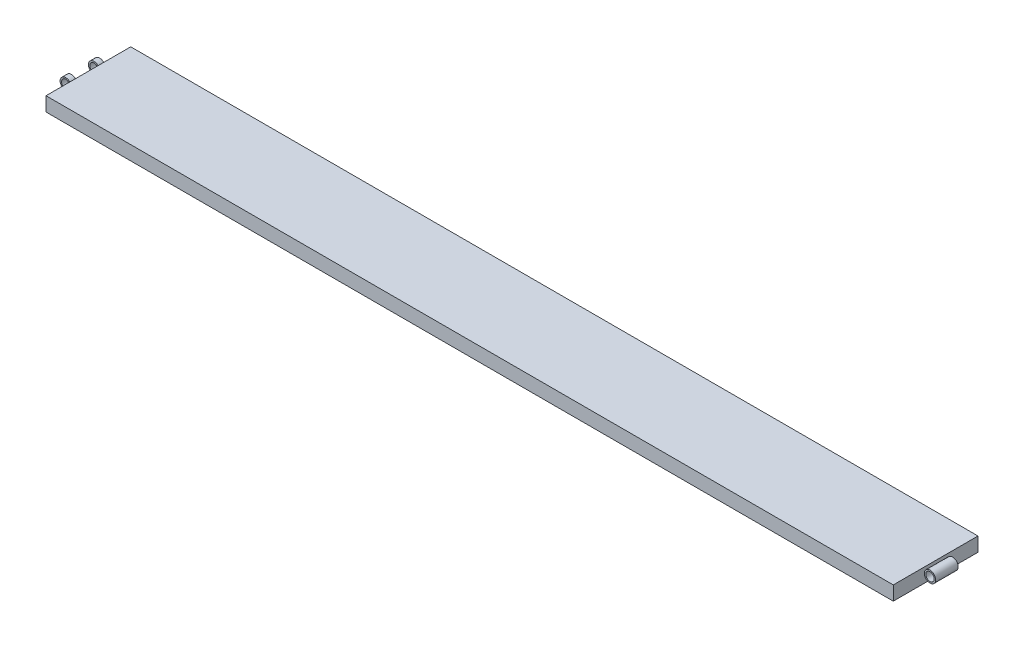
from build123d import *

# Parameters (mm, degrees)
SKETCH1_W                = 381
SKETCH1_H                = 38.1
BOSS_EXTRUDE1_DEPTH      = 6.35
SKETCH2_R                = 2.54
SKETCH2_R_2              = 1.905
BOSS_EXTRUDE2_DEPTH      = 1.27
LPATTERN1_COUNT          = 2
LPATTERN1_PITCH          = 12.7
BOSS_EXTRUDE4_DEPTH      = 5.08
BOSS_EXTRUDE4_DEPTH_BACK = 5.08
SKETCH4_R                = 2.54
SKETCH4_R_2              = 1.905


with BuildPart() as part:
    # Sketch1 → Boss-Extrude1 (new body)
    with BuildSketch(Plane(origin=(0, 0, 0), x_dir=(1, 0, 0), z_dir=(0, 1, 0))):
        with Locations((190.5, 19.05)):
            Rectangle(SKETCH1_W, SKETCH1_H)
    extrude(amount=BOSS_EXTRUDE1_DEPTH)


with BuildPart() as body_2:
    # Sketch2 → Boss-Extrude2 (new, symmetric)
    with BuildSketch(Plane.XY.offset(-12.7)):
        with Locations((-2.54, 3.872789775)):
            Circle(SKETCH2_R)
        with Locations((-2.54, 3.872789775)):
            Circle(SKETCH2_R_2, mode=Mode.SUBTRACT)
    boss_extrude2 = extrude(amount=BOSS_EXTRUDE2_DEPTH, both=True)


with BuildPart() as lpattern1_1:
    # LPattern1: Boss-Extrude2 ×2
    with Locations(*[(0, 0, -i * LPATTERN1_PITCH) for i in range(1, LPATTERN1_COUNT)]):
        add(boss_extrude2)


with BuildPart() as body_4:
    # Sketch4 → Boss-Extrude4 (new, two sides: drawn at the far end of the back side and taken through both)
    with BuildSketch(Plane.XY.offset(-19.05).offset(-BOSS_EXTRUDE4_DEPTH_BACK)):
        with Locations(Location((383.54, 3.872789775, 0), (0, 0, 180))):
            Circle(SKETCH4_R)
        with Locations(Location((383.54, 3.872789775, 0), (0, 0, 180))):
            Circle(SKETCH4_R_2, mode=Mode.SUBTRACT)
    extrude(amount=BOSS_EXTRUDE4_DEPTH + BOSS_EXTRUDE4_DEPTH_BACK)


solid = Compound([part.part, body_2.part, lpattern1_1.part, body_4.part])
